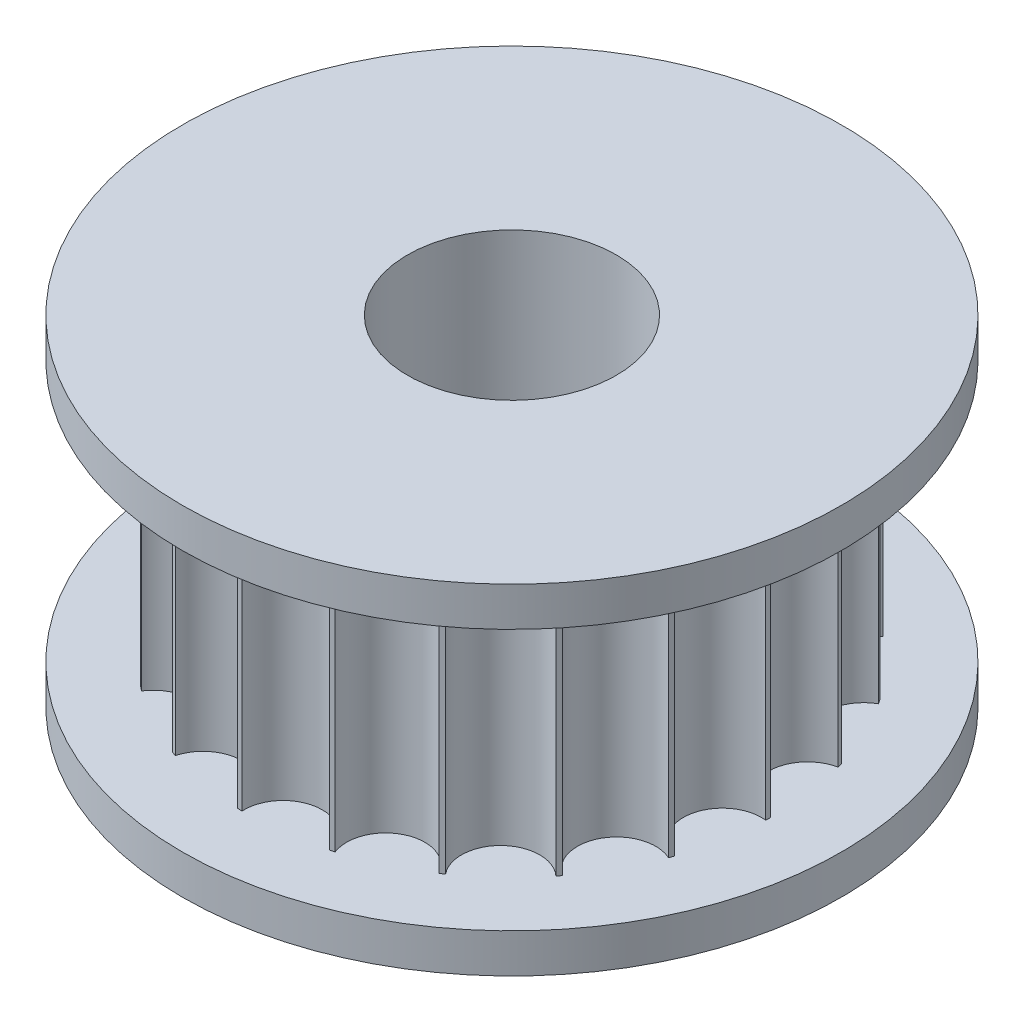
from build123d import *

# Parameters (mm, degrees)
SKETCH_2_R               = 1.5
CUT_EXTRUDE_3_DEPTH      = 10
PATTERN_CIRCULAR_2_COUNT = 20
SKETCH_3_R               = 4
CUT_EXTRUDE_4_DEPTH      = 23.085770306


with BuildPart() as part:
    # 草图1 → 旋转1 (revolve)
    with BuildSketch(Plane(origin=(0, 0, 0), x_dir=(0, 0, -1), z_dir=(1, 0, 0))):
        Polygon((0, 4.050451807), (0, 17.050451807), (-12.625, 17.050451807), (-12.625, 15.550451807), (-10.125, 15.550451807), (-10.125, 5.550451807), (-12.625, 5.550451807), (-12.625, 4.050451807), align=None)
    revolve(axis=Axis((0, 33.241716867, 0), (0, -1, 0)))

    # 草图2 → 切除-拉伸3 (cut)
    with BuildSketch(Plane.XZ.offset(-15.550451807)):
        with Locations((-10.043642365, 1.280965666)):
            Circle(SKETCH_2_R)
    cut_extrude_3 = extrude(amount=CUT_EXTRUDE_3_DEPTH, mode=Mode.SUBTRACT)

    # 阵列(圆周)2: 切除-拉伸3 ×20 about axis
    pattern_circular_2_axis = Axis((0, 0, 0), (0, 1, 0))
    for i in range(1, PATTERN_CIRCULAR_2_COUNT):
        add(cut_extrude_3.rotate(pattern_circular_2_axis, i * 360 / PATTERN_CIRCULAR_2_COUNT), mode=Mode.SUBTRACT)

    # 草图3 → 切除-拉伸4 (cut, through all)
    with BuildSketch(Plane.XZ.offset(-4.050451807)):
        with Locations(Location((0, 0, 0), (0, 0, 270))):
            Circle(SKETCH_3_R)
    extrude(amount=-CUT_EXTRUDE_4_DEPTH, mode=Mode.SUBTRACT)


solid = part.part
